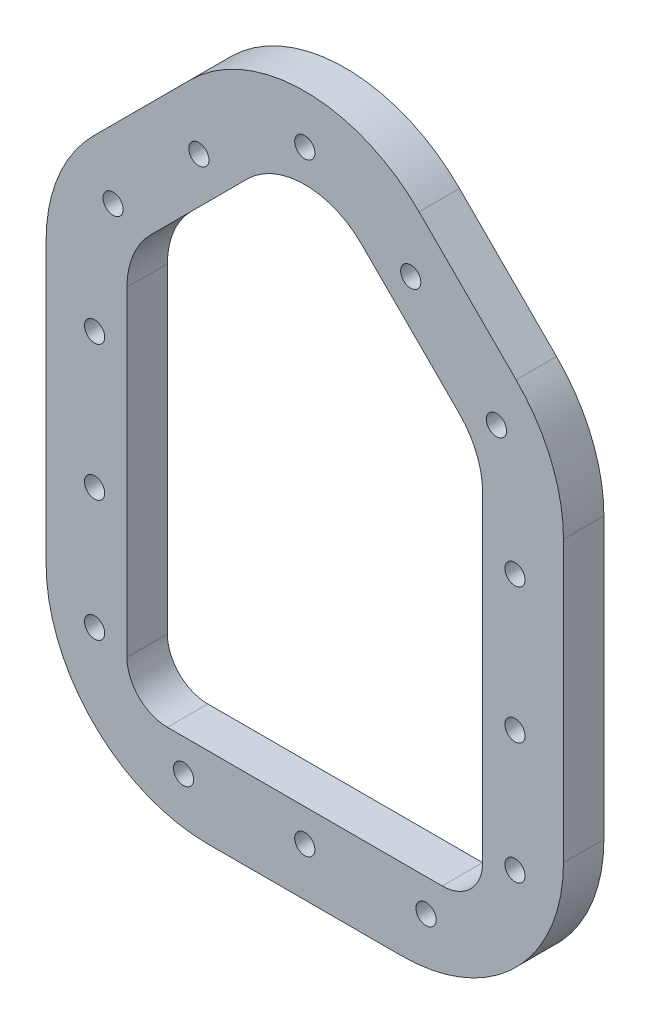
from build123d import *

# Parameters (mm, degrees)
SKETCH1_R           = 1.25
BOSS_EXTRUDE1_DEPTH = 5
FILLET1_R           = 20
FILLET2_R           = 5


with BuildPart() as part:
    # Sketch1 → Boss-Extrude1 (new body)
    with BuildSketch(Plane.XY):
        with BuildLine():
            Line((32, 5), (-32, 5))
            Line((-32, 5), (-32, 59.644660941))
            ThreePointArc((-32, 59.644660941), (-30.47759065, 67.298329588), (-26.142135624, 73.786796564))
            Line((-26.142135624, 73.786796564), (-14.142135624, 85.786796564))
            ThreePointArc((-14.142135624, 85.786796564), (0, 91.644660941), (14.142135624, 85.786796564))
            Line((14.142135624, 85.786796564), (26.142135624, 73.786796564))
            ThreePointArc((26.142135624, 73.786796564), (30.47759065, 67.298329588), (32, 59.644660941))
            Line((32, 59.644660941), (32, 5))
        make_face()
        with Locations((0, 85.644660941)):
            Circle(SKETCH1_R, mode=Mode.SUBTRACT)
        with Locations((-13.102089171, 78.341561643)):
            Circle(SKETCH1_R, mode=Mode.SUBTRACT)
        with Locations((-23.708690889, 67.734959925)):
            Circle(SKETCH1_R, mode=Mode.SUBTRACT)
        with Locations((-26, 52.910996131)):
            Circle(SKETCH1_R, mode=Mode.SUBTRACT)
        with Locations((-26, 36.198039027)):
            Circle(SKETCH1_R, mode=Mode.SUBTRACT)
        with Locations((-26, 21.198039027)):
            Circle(SKETCH1_R, mode=Mode.SUBTRACT)
        with Locations((0, 11)):
            Circle(SKETCH1_R, mode=Mode.SUBTRACT)
        with Locations((-15, 11)):
            Circle(SKETCH1_R, mode=Mode.SUBTRACT)
        with Locations(Location((13.102089171, 78.341561643, 0), (0, 0, 180))):
            Circle(SKETCH1_R, mode=Mode.SUBTRACT)
        with Locations(Location((23.708690889, 67.734959925, 0), (0, 0, 180))):
            Circle(SKETCH1_R, mode=Mode.SUBTRACT)
        with Locations(Location((26, 52.910996131, 0), (0, 0, 180))):
            Circle(SKETCH1_R, mode=Mode.SUBTRACT)
        with Locations(Location((26, 36.198039027, 0), (0, 0, 180))):
            Circle(SKETCH1_R, mode=Mode.SUBTRACT)
        with Locations(Location((26, 21.198039027, 0), (0, 0, 180))):
            Circle(SKETCH1_R, mode=Mode.SUBTRACT)
        with Locations(Location((15, 11, 0), (0, 0, 180))):
            Circle(SKETCH1_R, mode=Mode.SUBTRACT)
        with BuildLine():
            Line((-22, 59.644660941), (-22, 15))
            Line((-22, 15), (22, 15))
            Line((22, 15), (22, 59.644660941))
            ThreePointArc((22, 59.644660941), (21.238795325, 63.471495264), (19.071067812, 66.715728753))
            Line((19.071067812, 66.715728753), (7.071067812, 78.715728753))
            ThreePointArc((7.071067812, 78.715728753), (0, 81.644660941), (-7.071067812, 78.715728753))
            Line((-7.071067812, 78.715728753), (-19.071067812, 66.715728753))
            ThreePointArc((-19.071067812, 66.715728753), (-21.238795325, 63.471495264), (-22, 59.644660941))
        make_face(mode=Mode.SUBTRACT)
    extrude(amount=BOSS_EXTRUDE1_DEPTH)

    # Fillet1
    fillet1_edges = [part.edges().sort_by_distance(p)[0] for p in [
        (32, 5, 2.5),
        (-32, 5, 2.5),
    ]]
    fillet(fillet1_edges, radius=FILLET1_R)

    # Fillet2
    fillet2_edges = [part.edges().sort_by_distance(p)[0] for p in [
        (22, 15, 2.5),
        (-22, 15, 2.5),
    ]]
    fillet(fillet2_edges, radius=FILLET2_R)


solid = part.part
